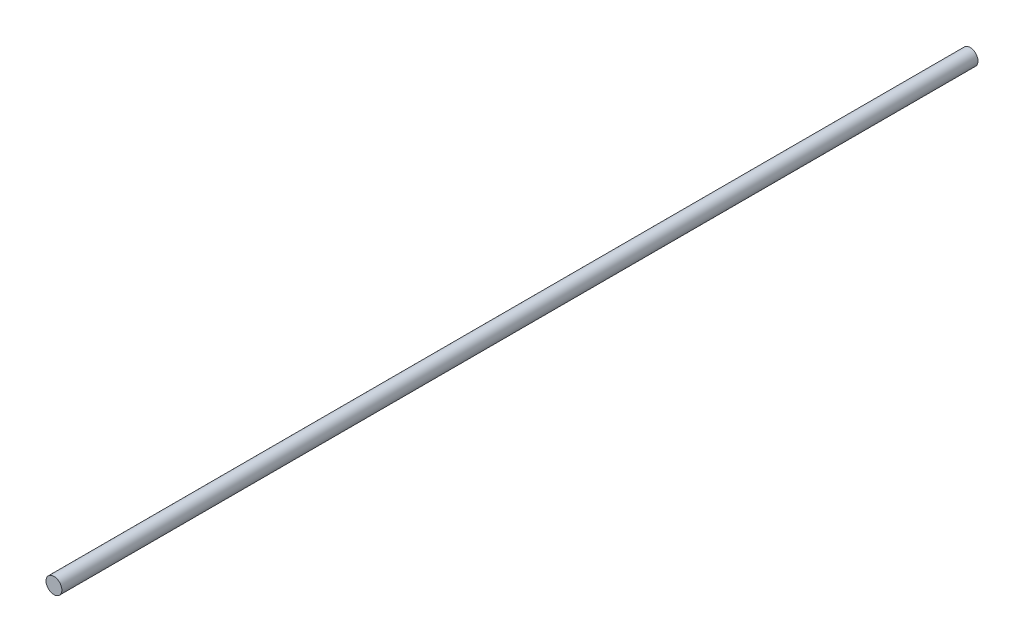
from build123d import *

# Parameters (mm, degrees)
SKETCH1_R           = 4
BOSS_EXTRUDE2_DEPTH = 231.25


with BuildPart() as part:
    # Sketch1 → Boss-Extrude2 (new, symmetric)
    with BuildSketch(Plane.XY):
        with Locations(Location((0, 0, 0), (0, 0, 180))):
            Circle(SKETCH1_R)
    extrude(amount=BOSS_EXTRUDE2_DEPTH, both=True)


solid = part.part
